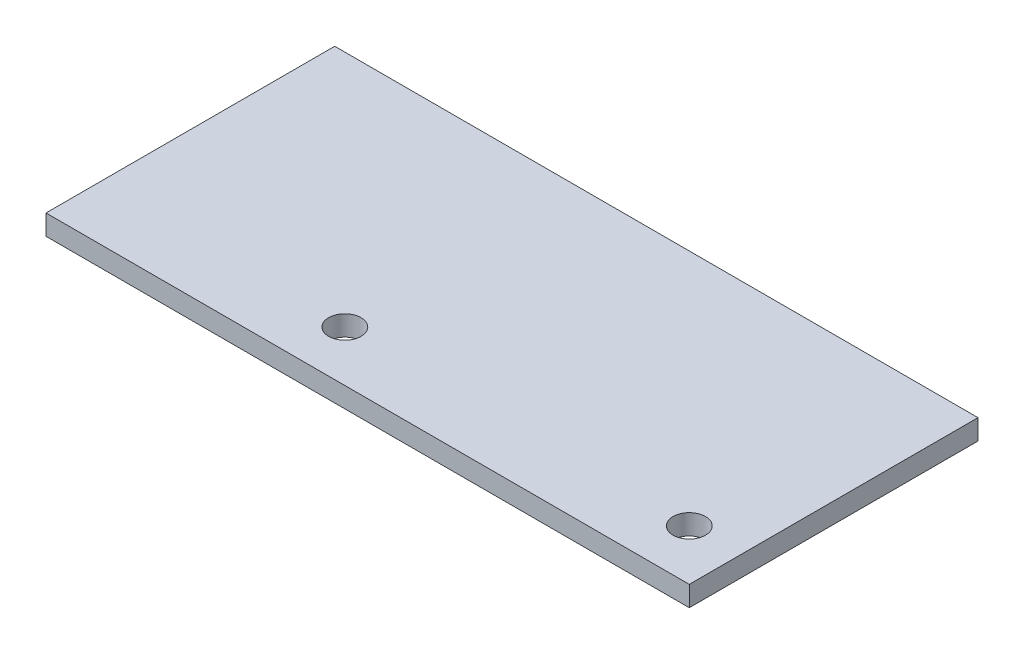
from build123d import *

# Parameters (mm, degrees)
SKETCH1_W           = 63.5
SKETCH1_H           = 28.5
SKETCH1_R           = 1.6
BOSS_EXTRUDE1_DEPTH = 2


with BuildPart() as part:
    # Sketch1 → Boss-Extrude1 (new body)
    with BuildSketch(Plane(origin=(0, 0, 0), x_dir=(1, 0, 0), z_dir=(0, 1, 0))):
        with Locations((31.75, 14.25)):
            Rectangle(SKETCH1_W, SKETCH1_H)
        with Locations(Location((58.5, 5, 0), (0, 0, 270))):
            Circle(SKETCH1_R, mode=Mode.SUBTRACT)
        with Locations(Location((24.5, 5, 0), (0, 0, 270))):
            Circle(SKETCH1_R, mode=Mode.SUBTRACT)
    extrude(amount=BOSS_EXTRUDE1_DEPTH)


solid = part.part
